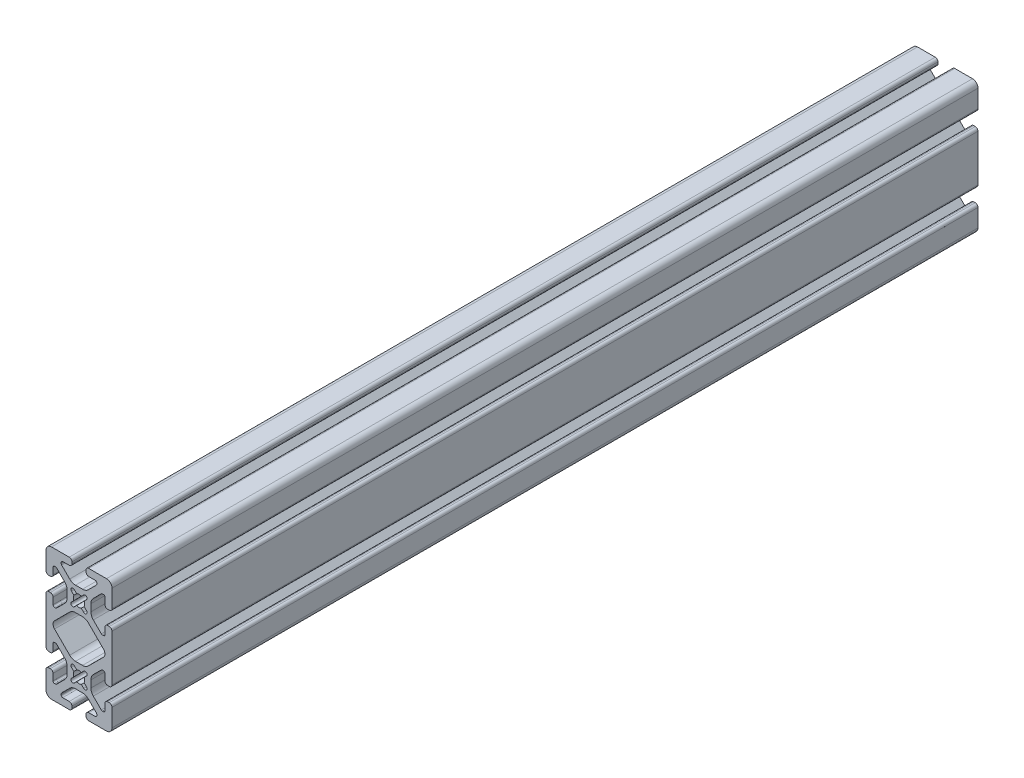
from build123d import *

# Parameters (mm, degrees)
EXTRUDE1_DEPTH = 500


with BuildPart() as part:
    # Sketch1 → Extrude1 (new body)
    with BuildSketch(Plane.XY):
        with BuildLine():
            Line((16.5608, 23.114), (17.4752, 23.114))
            ThreePointArc((17.4752, 23.114), (18.588751759, 23.575248241), (19.05, 24.6888))
            Line((19.05, 24.6888), (19.05, 34.925))
            ThreePointArc((19.05, 34.925), (18.12006403, 37.17006403), (15.875, 38.1))
            Line((15.875, 38.1), (5.6388, 38.1))
            ThreePointArc((5.6388, 38.1), (4.525248241, 37.638751759), (4.064, 36.5252))
            Line((4.064, 36.5252), (4.064, 35.6108))
            ThreePointArc((4.064, 35.6108), (4.525248241, 34.497248241), (5.6388, 34.036))
            Line((5.6388, 34.036), (9.398, 34.036))
            ThreePointArc((9.398, 34.036), (10.026617928, 33.775617928), (10.287, 33.147))
            Line((10.287, 33.147), (10.287, 32.578917816))
            ThreePointArc((10.287, 32.578917816), (10.219328904, 32.238712244), (10.026617929, 31.950299887))
            Line((10.026617929, 31.950299887), (5.38715839, 27.310840349))
            ThreePointArc((5.38715839, 27.310840349), (3.846212368, 26.281213135), (2.028542601, 25.919656138))
            Line((2.028542601, 25.919656138), (-2.028542601, 25.919656138))
            ThreePointArc((-2.028542601, 25.919656138), (-3.846212368, 26.281213135), (-5.38715839, 27.310840349))
            Line((-5.38715839, 27.310840349), (-10.026617928, 31.950299887))
            ThreePointArc((-10.026617928, 31.950299887), (-10.219328904, 32.238712244), (-10.287, 32.578917816))
            Line((-10.287, 32.578917816), (-10.287, 33.147))
            ThreePointArc((-10.287, 33.147), (-10.026617928, 33.775617928), (-9.398, 34.036))
            Line((-9.398, 34.036), (-5.6388, 34.036))
            ThreePointArc((-5.6388, 34.036), (-4.525248241, 34.497248241), (-4.064, 35.6108))
            Line((-4.064, 35.6108), (-4.064, 36.5252))
            ThreePointArc((-4.064, 36.5252), (-4.525248241, 37.638751759), (-5.6388, 38.1))
            Line((-5.6388, 38.1), (-15.875, 38.1))
            ThreePointArc((-15.875, 38.1), (-18.12006403, 37.17006403), (-19.05, 34.925))
            Line((-19.05, 34.925), (-19.05, 24.6888))
            ThreePointArc((-19.05, 24.6888), (-18.588751759, 23.575248241), (-17.4752, 23.114))
            Line((-17.4752, 23.114), (-16.5608, 23.114))
            ThreePointArc((-16.5608, 23.114), (-15.447248241, 23.575248241), (-14.986, 24.6888))
            Line((-14.986, 24.6888), (-14.986, 28.448))
            ThreePointArc((-14.986, 28.448), (-14.725617928, 29.076617928), (-14.097, 29.337))
            Line((-14.097, 29.337), (-13.528917816, 29.337))
            ThreePointArc((-13.528917816, 29.337), (-13.188712244, 29.269328904), (-12.900299887, 29.076617928))
            Line((-12.900299887, 29.076617928), (-8.260840349, 24.43715839))
            ThreePointArc((-8.260840349, 24.43715839), (-7.231213135, 22.896212368), (-6.869656138, 21.078542601))
            Line((-6.869656138, 21.078542601), (-6.869656138, 17.021457399))
            ThreePointArc((-6.869656138, 17.021457399), (-7.231213135, 15.203787632), (-8.260840349, 13.66284161))
            Line((-8.260840349, 13.66284161), (-12.900299887, 9.023382072))
            ThreePointArc((-12.900299887, 9.023382072), (-13.188712244, 8.830671096), (-13.528917816, 8.763))
            Line((-13.528917816, 8.763), (-14.097, 8.763))
            ThreePointArc((-14.097, 8.763), (-14.725617928, 9.023382072), (-14.986, 9.652))
            Line((-14.986, 9.652), (-14.986, 13.4112))
            ThreePointArc((-14.986, 13.4112), (-15.447248241, 14.524751759), (-16.5608, 14.986))
            Line((-16.5608, 14.986), (-17.4752, 14.986))
            ThreePointArc((-17.4752, 14.986), (-18.588751759, 14.524751759), (-19.05, 13.4112))
            Line((-19.05, 13.4112), (-19.05, -13.4112))
            ThreePointArc((-19.05, -13.4112), (-18.588751759, -14.524751759), (-17.4752, -14.986))
            Line((-17.4752, -14.986), (-16.5608, -14.986))
            ThreePointArc((-16.5608, -14.986), (-15.447248241, -14.524751759), (-14.986, -13.4112))
            Line((-14.986, -13.4112), (-14.986, -9.652))
            ThreePointArc((-14.986, -9.652), (-14.725617928, -9.023382072), (-14.097, -8.763))
            Line((-14.097, -8.763), (-13.528917816, -8.763))
            ThreePointArc((-13.528917816, -8.763), (-13.188712244, -8.830671096), (-12.900299887, -9.023382072))
            Line((-12.900299887, -9.023382072), (-8.260840349, -13.66284161))
            ThreePointArc((-8.260840349, -13.66284161), (-7.231213135, -15.203787632), (-6.869656138, -17.021457399))
            Line((-6.869656138, -17.021457399), (-6.869656138, -21.078542601))
            ThreePointArc((-6.869656138, -21.078542601), (-7.231213135, -22.896212368), (-8.260840349, -24.43715839))
            Line((-8.260840349, -24.43715839), (-12.900299887, -29.076617928))
            ThreePointArc((-12.900299887, -29.076617928), (-13.188712244, -29.269328904), (-13.528917816, -29.337))
            Line((-13.528917816, -29.337), (-14.097, -29.337))
            ThreePointArc((-14.097, -29.337), (-14.725617928, -29.076617928), (-14.986, -28.448))
            Line((-14.986, -28.448), (-14.986, -24.6888))
            ThreePointArc((-14.986, -24.6888), (-15.447248241, -23.575248241), (-16.5608, -23.114))
            Line((-16.5608, -23.114), (-17.4752, -23.114))
            ThreePointArc((-17.4752, -23.114), (-18.588751759, -23.575248241), (-19.05, -24.6888))
            Line((-19.05, -24.6888), (-19.05, -34.925))
            ThreePointArc((-19.05, -34.925), (-18.12006403, -37.17006403), (-15.875, -38.1))
            Line((-15.875, -38.1), (-5.6388, -38.1))
            ThreePointArc((-5.6388, -38.1), (-4.525248241, -37.638751759), (-4.064, -36.5252))
            Line((-4.064, -36.5252), (-4.064, -35.6108))
            ThreePointArc((-4.064, -35.6108), (-4.525248241, -34.497248241), (-5.6388, -34.036))
            Line((-5.6388, -34.036), (-9.398, -34.036))
            ThreePointArc((-9.398, -34.036), (-10.026617928, -33.775617928), (-10.287, -33.147))
            Line((-10.287, -33.147), (-10.287, -32.578917816))
            ThreePointArc((-10.287, -32.578917816), (-10.219328904, -32.238712244), (-10.026617929, -31.950299887))
            Line((-10.026617929, -31.950299887), (-5.38715839, -27.310840349))
            ThreePointArc((-5.38715839, -27.310840349), (-3.846212368, -26.281213135), (-2.028542601, -25.919656138))
            Line((-2.028542601, -25.919656138), (2.028542601, -25.919656138))
            ThreePointArc((2.028542601, -25.919656138), (3.846212368, -26.281213135), (5.38715839, -27.310840349))
            Line((5.38715839, -27.310840349), (10.026617928, -31.950299887))
            ThreePointArc((10.026617928, -31.950299887), (10.219328904, -32.238712244), (10.287, -32.578917816))
            Line((10.287, -32.578917816), (10.287, -33.147))
            ThreePointArc((10.287, -33.147), (10.026617928, -33.775617928), (9.398, -34.036))
            Line((9.398, -34.036), (5.6388, -34.036))
            ThreePointArc((5.6388, -34.036), (4.525248241, -34.497248241), (4.064, -35.6108))
            Line((4.064, -35.6108), (4.064, -36.5252))
            ThreePointArc((4.064, -36.5252), (4.525248241, -37.638751759), (5.6388, -38.1))
            Line((5.6388, -38.1), (15.875, -38.1))
            ThreePointArc((15.875, -38.1), (18.12006403, -37.17006403), (19.05, -34.925))
            Line((19.05, -34.925), (19.05, -24.6888))
            ThreePointArc((19.05, -24.6888), (18.588751759, -23.575248241), (17.4752, -23.114))
            Line((17.4752, -23.114), (16.5608, -23.114))
            ThreePointArc((16.5608, -23.114), (15.447248241, -23.575248241), (14.986, -24.6888))
            Line((14.986, -24.6888), (14.986, -28.448))
            ThreePointArc((14.986, -28.448), (14.725617928, -29.076617928), (14.097, -29.337))
            Line((14.097, -29.337), (13.528917816, -29.337))
            ThreePointArc((13.528917816, -29.337), (13.188712244, -29.269328904), (12.900299887, -29.076617928))
            Line((12.900299887, -29.076617928), (8.260840349, -24.43715839))
            ThreePointArc((8.260840349, -24.43715839), (7.231213135, -22.896212368), (6.869656138, -21.078542601))
            Line((6.869656138, -21.078542601), (6.869656138, -17.021457399))
            ThreePointArc((6.869656138, -17.021457399), (7.231213135, -15.203787632), (8.260840349, -13.66284161))
            Line((8.260840349, -13.66284161), (12.900299887, -9.023382072))
            ThreePointArc((12.900299887, -9.023382072), (13.188712244, -8.830671096), (13.528917816, -8.763))
            Line((13.528917816, -8.763), (14.097, -8.763))
            ThreePointArc((14.097, -8.763), (14.725617928, -9.023382072), (14.986, -9.652))
            Line((14.986, -9.652), (14.986, -13.4112))
            ThreePointArc((14.986, -13.4112), (15.447248241, -14.524751759), (16.5608, -14.986))
            Line((16.5608, -14.986), (17.4752, -14.986))
            ThreePointArc((17.4752, -14.986), (18.588751759, -14.524751759), (19.05, -13.4112))
            Line((19.05, -13.4112), (19.05, 13.4112))
            ThreePointArc((19.05, 13.4112), (18.588751759, 14.524751759), (17.4752, 14.986))
            Line((17.4752, 14.986), (16.5608, 14.986))
            ThreePointArc((16.5608, 14.986), (15.447248241, 14.524751759), (14.986, 13.4112))
            Line((14.986, 13.4112), (14.986, 9.652))
            ThreePointArc((14.986, 9.652), (14.725617928, 9.023382072), (14.097, 8.763))
            Line((14.097, 8.763), (13.528917816, 8.763))
            ThreePointArc((13.528917816, 8.763), (13.188712244, 8.830671096), (12.900299887, 9.023382072))
            Line((12.900299887, 9.023382072), (8.260840349, 13.66284161))
            ThreePointArc((8.260840349, 13.66284161), (7.231213135, 15.203787632), (6.869656138, 17.021457399))
            Line((6.869656138, 17.021457399), (6.869656138, 21.078542601))
            ThreePointArc((6.869656138, 21.078542601), (7.231213135, 22.896212368), (8.260840349, 24.43715839))
            Line((8.260840349, 24.43715839), (12.900299887, 29.076617928))
            ThreePointArc((12.900299887, 29.076617928), (13.188712244, 29.269328904), (13.528917816, 29.337))
            Line((13.528917816, 29.337), (14.097, 29.337))
            ThreePointArc((14.097, 29.337), (14.725617928, 29.076617928), (14.986, 28.448))
            Line((14.986, 28.448), (14.986, 24.6888))
            ThreePointArc((14.986, 24.6888), (15.447248241, 23.575248241), (16.5608, 23.114))
        make_face()
        with BuildLine():
            Line((4.24561082, -16.410238803), (2.972880026, -17.693566075))
            ThreePointArc((2.972880026, -17.693566075), (3.26771, -19.05), (2.972880026, -20.406433925))
            Line((2.972880026, -20.406433925), (4.343300873, -21.776854771))
            ThreePointArc((4.343300873, -21.776854771), (4.343300873, -23.393300873), (2.726854771, -23.393300873))
            Line((2.726854771, -23.393300873), (1.356433925, -22.022880027))
            ThreePointArc((1.356433925, -22.022880027), (0, -22.31771), (-1.356433925, -22.022880027))
            Line((-1.356433925, -22.022880027), (-2.726854771, -23.393300873))
            ThreePointArc((-2.726854771, -23.393300873), (-4.343300873, -23.393300873), (-4.343300873, -21.776854771))
            Line((-4.343300873, -21.776854771), (-2.972880026, -20.406433925))
            ThreePointArc((-2.972880026, -20.406433925), (-3.26771, -19.05), (-2.972880026, -17.693566075))
            Line((-2.972880026, -17.693566075), (-4.343300873, -16.323145229))
            ThreePointArc((-4.343300873, -16.323145229), (-4.343300873, -14.706699127), (-2.726854771, -14.706699127))
            Line((-2.726854771, -14.706699127), (-1.356433925, -16.077119973))
            ThreePointArc((-1.356433925, -16.077119973), (0, -15.78229), (1.356433925, -16.077119973))
            Line((1.356433925, -16.077119973), (2.639761197, -14.80438918))
            ThreePointArc((2.639761197, -14.80438918), (4.343300873, -14.706699127), (4.24561082, -16.410238803))
        make_face(mode=Mode.SUBTRACT)
        with BuildLine():
            Line((14.110859134, -2.065458879), (5.38715839, -10.789159651))
            ThreePointArc((5.38715839, -10.789159651), (3.846212368, -11.818786865), (2.028542601, -12.180343862))
            Line((2.028542601, -12.180343862), (-2.028542601, -12.180343862))
            ThreePointArc((-2.028542601, -12.180343862), (-3.846212368, -11.818786865), (-5.38715839, -10.789159651))
            Line((-5.38715839, -10.789159651), (-14.110859131, -2.065458901))
            ThreePointArc((-14.110859131, -2.065458901), (-14.966400226, 6e-09), (-14.110859135, 2.065458914))
            Line((-14.110859135, 2.065458914), (-5.38715839, 10.789159651))
            ThreePointArc((-5.38715839, 10.789159651), (-3.846212368, 11.818786865), (-2.028542601, 12.180343862))
            Line((-2.028542601, 12.180343862), (2.028542601, 12.180343862))
            ThreePointArc((2.028542601, 12.180343862), (3.846212368, 11.818786865), (5.38715839, 10.789159651))
            Line((5.38715839, 10.789159651), (14.110859134, 2.065458937))
            ThreePointArc((14.110859134, 2.065458937), (14.966400226, 2.9e-08), (14.110859134, -2.065458879))
        make_face(mode=Mode.SUBTRACT)
        with BuildLine():
            Line((4.24561082, 21.689761197), (2.972880026, 20.406433925))
            ThreePointArc((2.972880026, 20.406433925), (3.26771, 19.05), (2.972880026, 17.693566075))
            Line((2.972880026, 17.693566075), (4.343300873, 16.323145229))
            ThreePointArc((4.343300873, 16.323145229), (4.343300873, 14.706699127), (2.726854771, 14.706699127))
            Line((2.726854771, 14.706699127), (1.356433925, 16.077119973))
            ThreePointArc((1.356433925, 16.077119973), (0, 15.78229), (-1.356433925, 16.077119973))
            Line((-1.356433925, 16.077119973), (-2.726854771, 14.706699127))
            ThreePointArc((-2.726854771, 14.706699127), (-4.343300873, 14.706699127), (-4.343300873, 16.323145229))
            Line((-4.343300873, 16.323145229), (-2.972880026, 17.693566075))
            ThreePointArc((-2.972880026, 17.693566075), (-3.26771, 19.05), (-2.972880026, 20.406433925))
            Line((-2.972880026, 20.406433925), (-4.343300873, 21.776854771))
            ThreePointArc((-4.343300873, 21.776854771), (-4.343300873, 23.393300873), (-2.726854771, 23.393300873))
            Line((-2.726854771, 23.393300873), (-1.356433925, 22.022880027))
            ThreePointArc((-1.356433925, 22.022880027), (0, 22.31771), (1.356433925, 22.022880027))
            Line((1.356433925, 22.022880027), (2.639761197, 23.29561082))
            ThreePointArc((2.639761197, 23.29561082), (4.343300873, 23.393300873), (4.24561082, 21.689761197))
        make_face(mode=Mode.SUBTRACT)
    extrude(amount=-EXTRUDE1_DEPTH)


solid = part.part
